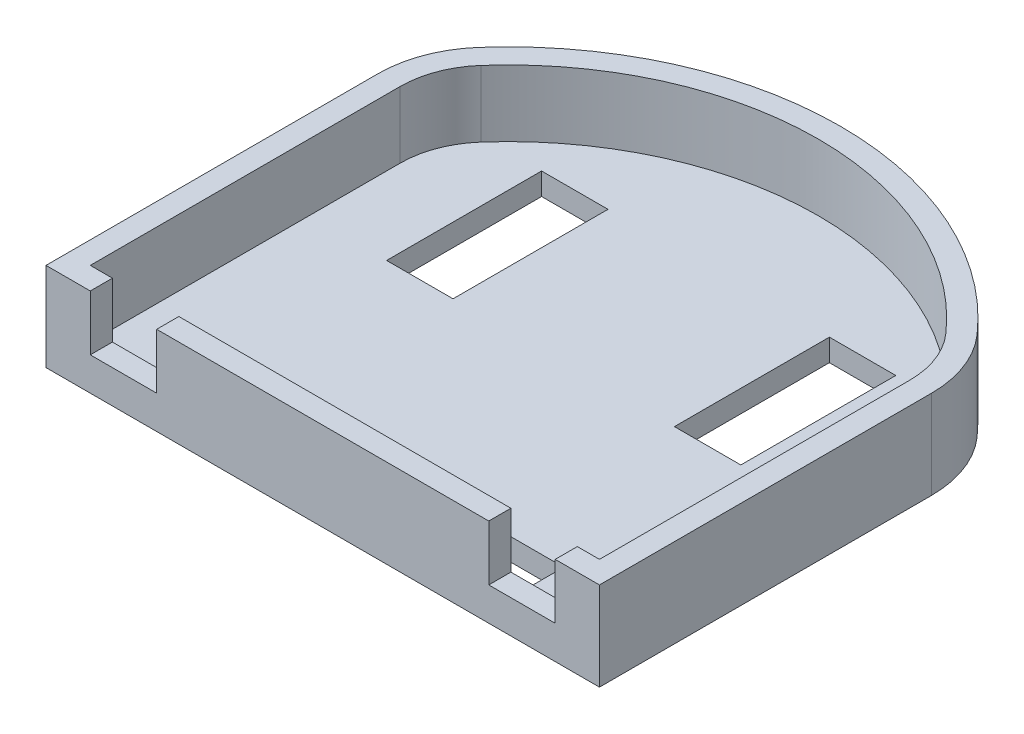
from build123d import *

# Parameters (mm, degrees)
BOSS_EXTRUDE1_DEPTH = 40
SHELL1_T            = -10
SKETCH2_W           = 30
SKETCH2_H           = 70
SKETCH2_W_2         = 160
SKETCH2_H_2         = 15
CUT_EXTRUDE1_DEPTH  = 198.547462651
CUT_EXTRUDE2_REACH  = 270.167
SKETCH3_W           = 30
SKETCH3_H           = 50


with BuildPart() as part:
    # Sketch1 → Boss-Extrude1 (new body)
    with BuildSketch(Plane(origin=(0, 0, 0), x_dir=(1, 0, 0), z_dir=(0, 1, 0))):
        with BuildLine():
            Line((125, 66.143782777), (125, -83.856217223))
            Line((125, -83.856217223), (-125, -83.856217223))
            Line((-125, -83.856217223), (-125, 66.143782777))
            ThreePointArc((-125, 66.143782777), (-121.770717335, 83.821452306), (-112.5, 99.215674165))
            ThreePointArc((-112.5, 99.215674165), (0, 150), (112.5, 99.215674165))
            ThreePointArc((112.5, 99.215674165), (121.770717335, 83.821452306), (125, 66.143782777))
        make_face()
    extrude(amount=BOSS_EXTRUDE1_DEPTH)

    # Shell1
    shell1_openings = [part.faces().sort_by_distance(p)[0] for p in [
        (0, 40, -23.901312182),
    ]]
    offset(amount=SHELL1_T, openings=shell1_openings, kind=Kind.INTERSECTION)

    # Sketch2 → Cut-Extrude1 (cut, through all)
    with BuildSketch(Plane(origin=(0, 10, 0), x_dir=(1, 0, 0), z_dir=(0, 1, 0))):
        with Locations((-65, 60)):
            Rectangle(SKETCH2_W, SKETCH2_H)
        with Locations((65, 60)):
            Rectangle(SKETCH2_W, SKETCH2_H)
        with Locations((0, -62.5)):
            Rectangle(SKETCH2_W_2, SKETCH2_H_2)
    extrude(amount=-CUT_EXTRUDE1_DEPTH, mode=Mode.SUBTRACT)

    # Sketch3 → Cut-Extrude2 (cut, up to next)
    with BuildSketch(Plane.XY.offset(83.856217223), mode=Mode.PRIVATE) as cut_extrude2_sk1:
        with Locations((-90, 40)):
            Rectangle(SKETCH3_W, SKETCH3_H)
    cut_extrude2_tool1 = extrude(cut_extrude2_sk1.sketch, amount=-CUT_EXTRUDE2_REACH, mode=Mode.PRIVATE) & part.part
    # Sketch3 → Cut-Extrude2 (cut, up to next)
    with BuildSketch(Plane.XY.offset(83.856217223), mode=Mode.PRIVATE) as cut_extrude2_sk2:
        with Locations((90, 40)):
            Rectangle(SKETCH3_W, SKETCH3_H)
    cut_extrude2_tool2 = extrude(cut_extrude2_sk2.sketch, amount=-CUT_EXTRUDE2_REACH, mode=Mode.PRIVATE) & part.part
    add(cut_extrude2_tool1.solids().sort_by_distance((-90, 40, 83.856217))[0], mode=Mode.SUBTRACT)
    add(cut_extrude2_tool2.solids().sort_by_distance((90, 40, 83.856217))[0], mode=Mode.SUBTRACT)


solid = part.part
